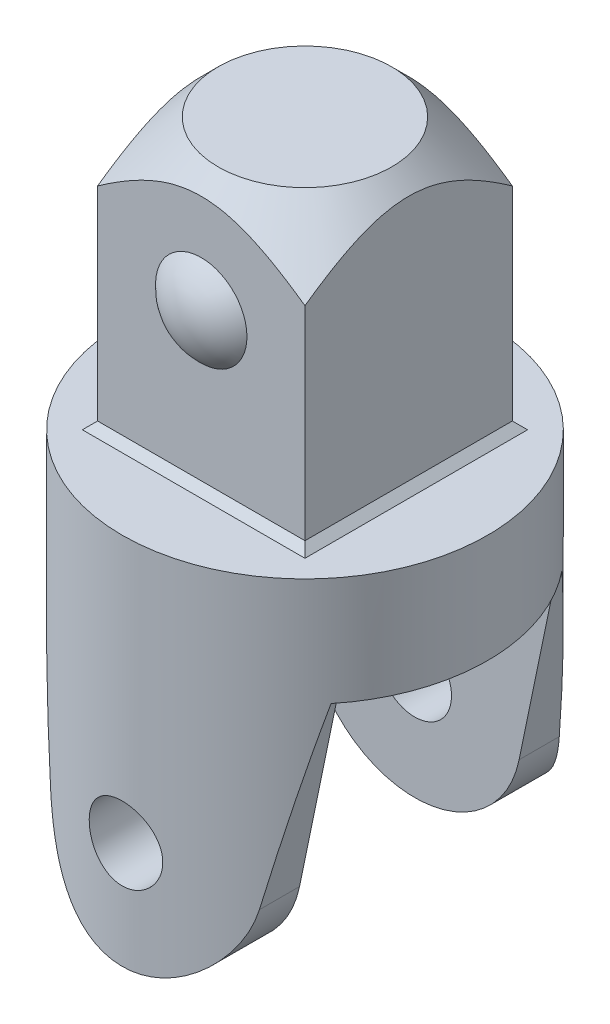
from build123d import *

# Parameters (mm, degrees)
SKETCH1_R           = 12
BOSS_EXTRUDE1_DEPTH = 33.53
CUT_EXTRUDE1_DEPTH  = 19.6
CHAMFER1_SIZE       = 0.4
SKETCH3_R           = 9.375
CUT_EXTRUDE2_DEPTH  = 3.4
CUT_EXTRUDE2_DRAFT  = -35
SKETCH4_W           = 24
SKETCH4_H           = 14.42225279
CUT_EXTRUDE3_DEPTH  = 17.4
SKETCH5_R           = 2.415
CUT_EXTRUDE4_DEPTH  = 33.7
CUT_EXTRUDE5_START  = -9
SKETCH6_R           = 12
CUT_EXTRUDE5_DEPTH  = 9
BOSS_EXTRUDE2_START = -7.13
SKETCH7_R           = 12
BOSS_EXTRUDE2_DEPTH = 7.13
SKETCH8_W           = 13.62
SKETCH8_H           = 13.62
BOSS_EXTRUDE3_DEPTH = 17.8
CHAMFER2_SIZE       = 0.5
SCALE1_SCALE        = 0.49


with BuildPart() as part:
    # Sketch1 → Boss-Extrude1 (new body)
    with BuildSketch(Plane(origin=(0, 0, 0), x_dir=(1, 0, 0), z_dir=(0, 1, 0))):
        with Locations(Location((0, 0, 0), (0, 0, 270))):
            Circle(SKETCH1_R)
    extrude(amount=BOSS_EXTRUDE1_DEPTH)

    # Sketch2 → Cut-Extrude1 (cut)
    with BuildSketch(Plane(origin=(0, 33.53, 0), x_dir=(1, 0, 0), z_dir=(0, 1, 0))):
        with BuildLine():
            Line((-6.5, 6.5), (-2.5, 6.5))
            ThreePointArc((-2.5, 6.5), (0, 7.211126395), (2.5, 6.5))
            Line((2.5, 6.5), (6.5, 6.5))
            Line((6.5, 6.5), (6.5, 2.5))
            ThreePointArc((6.5, 2.5), (7.211126395, 0), (6.5, -2.5))
            Line((6.5, -2.5), (6.5, -6.5))
            Line((6.5, -6.5), (2.5, -6.5))
            ThreePointArc((2.5, -6.5), (0, -7.211126395), (-2.5, -6.5))
            Line((-2.5, -6.5), (-6.5, -6.5))
            Line((-6.5, -6.5), (-6.5, -2.5))
            ThreePointArc((-6.5, -2.5), (-7.211126395, 0), (-6.5, 2.5))
            Line((-6.5, 2.5), (-6.5, 6.5))
        make_face()
    extrude(amount=-CUT_EXTRUDE1_DEPTH, mode=Mode.SUBTRACT)

    # Chamfer1
    chamfer1_edges = [part.edges().sort_by_distance(p)[0] for p in [
        (-6.5, 23.73, -6.5),
        (6.5, 23.73, -6.5),
        (6.5, 23.73, 6.5),
        (-6.5, 23.73, 6.5),
    ]]
    chamfer(chamfer1_edges, length=CHAMFER1_SIZE)


with BuildPart() as cut_extrude2_tool:
    # Sketch3 → Cut-Extrude2 (with draft: the straight prism first)
    with BuildSketch(Plane(origin=(0, 33.53, 0), x_dir=(1, 0, 0), z_dir=(0, 1, 0))):
        Circle(SKETCH3_R)
    extrude(amount=-CUT_EXTRUDE2_DEPTH)
    # Cut-Extrude2: the draft: its side faces are tilted about the plane it starts from
    cut_extrude2_sides = [cut_extrude2_tool.faces().sort_by_distance(p)[0] for p in [
        (-9.375, 31.83, 0),
    ]]
    draft(cut_extrude2_sides, Plane(origin=(0, 33.53, 0), x_dir=(1, 0, 0), z_dir=(0, 1, 0)), CUT_EXTRUDE2_DRAFT)


with BuildPart() as part_1:
    add(part.part)

    # Cut-Extrude2: cut by cut_extrude2_tool
    add(cut_extrude2_tool.part, mode=Mode.SUBTRACT)

    # Sketch4 → Cut-Extrude3 (cut)
    with BuildSketch(Plane.XZ):
        Rectangle(SKETCH4_W, SKETCH4_H)
    extrude(amount=-CUT_EXTRUDE3_DEPTH, mode=Mode.SUBTRACT)

    # Sketch5 → Cut-Extrude4 (cut, symmetric)
    with BuildSketch(Plane.XY):
        with Locations(Location((0, 7, 0), (0, 0, 90))):
            Circle(SKETCH5_R)
        with BuildLine():
            ThreePointArc((-6.854820161, 5.581747356), (0, 0), (6.854820161, 5.581747356))
            Line((6.854820161, 5.581747356), (9.3, 17.4))
            Line((9.3, 17.4), (12, 17.4))
            Line((12, 17.4), (12, -3.192277431))
            Line((12, -3.192277431), (-12, -3.192277431))
            Line((-12, -3.192277431), (-12, 17.4))
            Line((-12, 17.4), (-9.3, 17.4))
            Line((-9.3, 17.4), (-6.854820161, 5.581747356))
        make_face()
    extrude(amount=CUT_EXTRUDE4_DEPTH, both=True, mode=Mode.SUBTRACT)

    # Sketch6 → Cut-Extrude5 (cut)
    with BuildSketch(Plane(origin=(0, 33.53, 0), x_dir=(1, 0, 0), z_dir=(0, 1, 0)).offset(CUT_EXTRUDE5_START)):
        with Locations(Location((0, 0, 0), (0, 0, 55.16360803))):
            Circle(SKETCH6_R)
    extrude(amount=CUT_EXTRUDE5_DEPTH, mode=Mode.SUBTRACT)

    # Sketch7 → Boss-Extrude2 (add)
    with BuildSketch(Plane(origin=(0, 24.53, 0), x_dir=(1, 0, 0), z_dir=(0, 1, 0)).offset(BOSS_EXTRUDE2_START)):
        with Locations(Location((0, 0, 0), (0, 0, 55.16360803))):
            Circle(SKETCH7_R)
    extrude(amount=BOSS_EXTRUDE2_DEPTH)

    # Sketch8 → Boss-Extrude3 (add)
    with BuildSketch(Plane(origin=(0, 24.53, 0), x_dir=(1, 0, 0), z_dir=(0, 1, 0))):
        Rectangle(SKETCH8_W, SKETCH8_H)
    extrude(amount=BOSS_EXTRUDE3_DEPTH)

    # Sketch9 → Cut-Revolve1 (revolve, cut)
    with BuildSketch(Plane.XY, mode=Mode.PRIVATE) as cut_revolve1_sk:
        Polygon((5.7, 42.33), (13.111265215, 42.33), (13.111265215, 34.918734785), align=None)
    revolve(cut_revolve1_sk.sketch.rotate(Axis((0, 44.4465, 0), (0, -1, 0)), 304.83639197), axis=Axis((0, 44.4465, 0), (0, -1, 0)), mode=Mode.SUBTRACT)

    # Chamfer2
    chamfer2_edges = [part_1.edges().sort_by_distance(p)[0] for p in [
        (6.81, 24.53, 0),
        (0, 24.53, -6.81),
        (-6.81, 24.53, 0),
        (0, 24.53, 6.81),
    ]]
    chamfer(chamfer2_edges, length=CHAMFER2_SIZE)

    # Sketch10 → Revolve1 (revolve)
    with BuildSketch(Plane(origin=(0, 0, 0), x_dir=(0, 0, -1), z_dir=(1, 0, 0))):
        with BuildLine():
            Line((6.81, 34.73), (6.81, 31.73))
            ThreePointArc((6.81, 31.73), (7.806952033, 33.085121585), (8.16, 34.73))
            Line((8.16, 34.73), (6.81, 34.73))
        make_face()
    revolve1 = revolve(axis=Axis((0, 34.73, -6.81), (0, 0, -1)))

    # Mirror1: Revolve1 across plane
    add(revolve1.mirror(Plane.XY))


with BuildPart() as part_2:
    # Scale1: scaled about (-1.67e-07, 23.367427714, 2.93e-06)
    add(part_1.part.scale(SCALE1_SCALE).moved(Location((-8.5e-08, 11.917388134, 1.494e-06))))


solid = part_2.part
